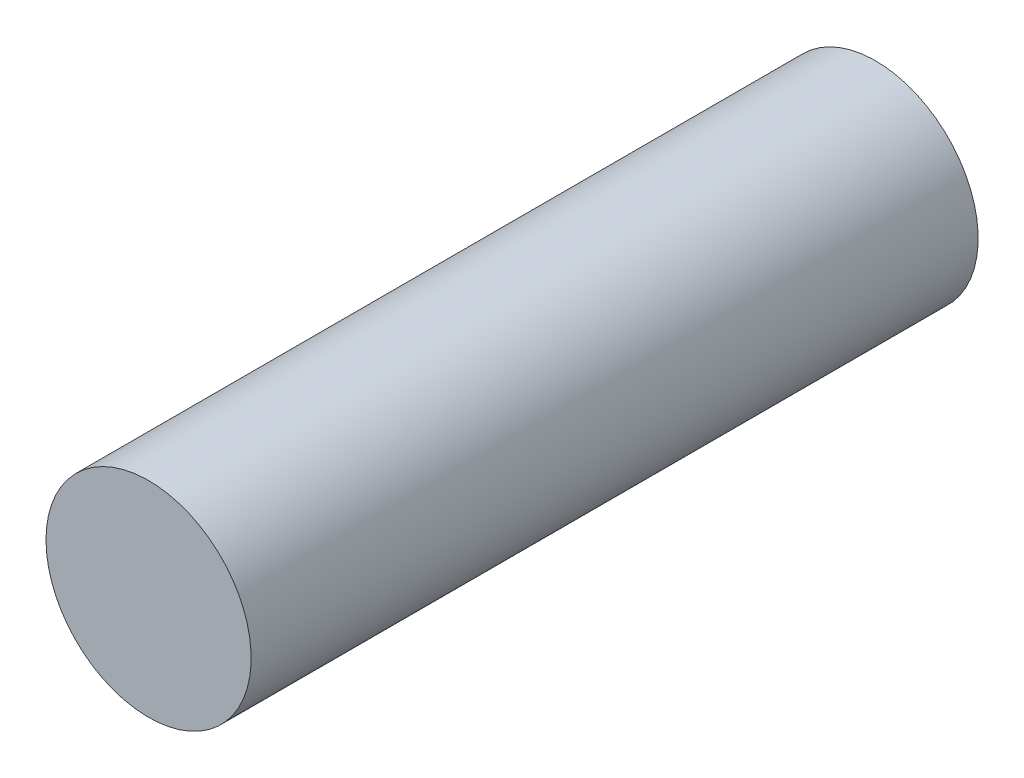
from build123d import *

# Parameters (mm, degrees)
SKETCH1_R           = 3.2
BOSS_EXTRUDE1_DEPTH = 22.68
SCALE_1_SCALE       = 2


with BuildPart() as part:
    # Sketch1 → Boss-Extrude1 (new body)
    with BuildSketch(Plane.XY):
        with Locations(Location((0, 0, 0), (0, 0, 180))):
            Circle(SKETCH1_R)
    extrude(amount=BOSS_EXTRUDE1_DEPTH)


with BuildPart() as part_1:
    # 缩放比例1: scaled about (0, 0, 11.34)
    add(part.part.scale(SCALE_1_SCALE).moved(Location((0, 0, -11.34))))


solid = part_1.part
